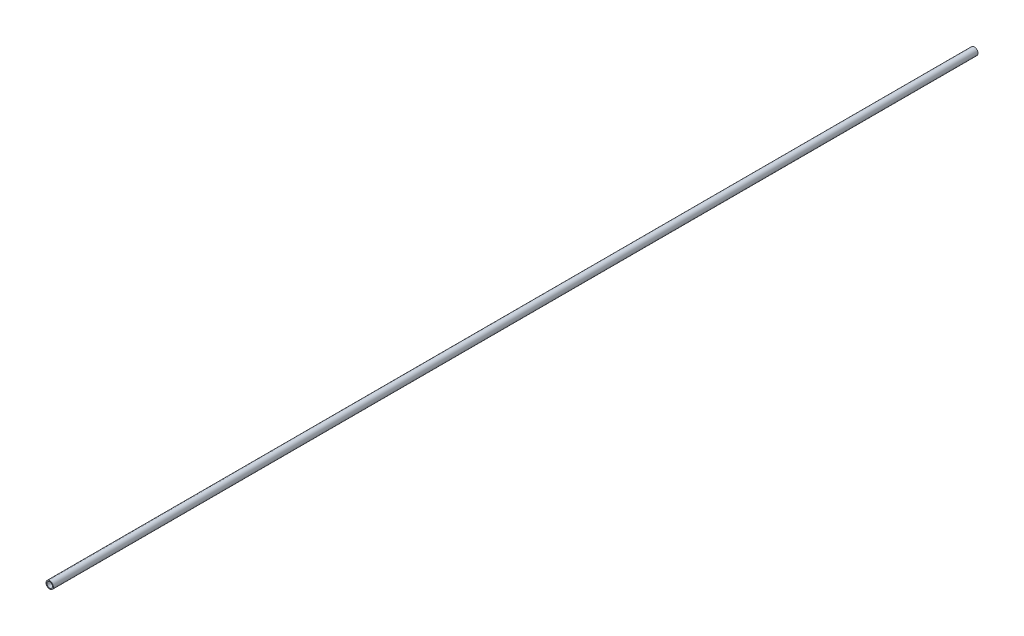
from build123d import *

# Parameters (mm, degrees)
SKETCH2_R           = 4
SKETCH2_R_2         = 3
BOSS_EXTRUDE1_DEPTH = 1000


with BuildPart() as part:
    # Sketch2 → Boss-Extrude1 (new body)
    with BuildSketch(Plane.XY):
        Circle(SKETCH2_R)
        Circle(SKETCH2_R_2, mode=Mode.SUBTRACT)
    extrude(amount=BOSS_EXTRUDE1_DEPTH)


solid = part.part
